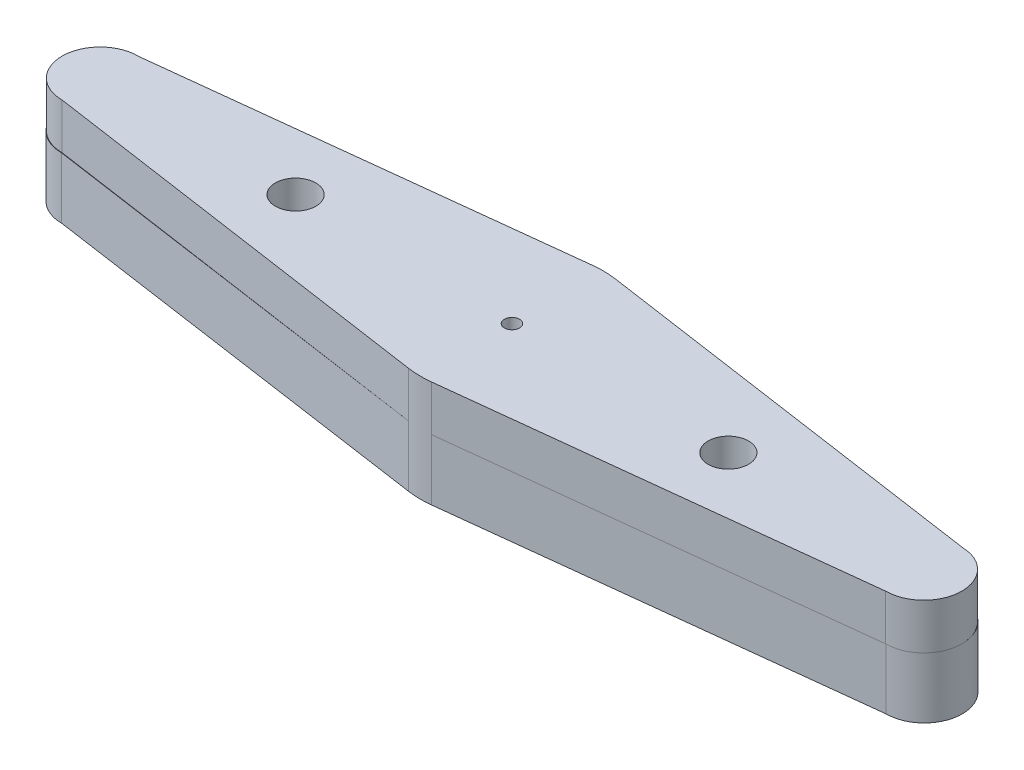
from build123d import *

# Parameters (mm, degrees)
BOSS_EXTRUDE2_DEPTH = 4
SKETCH2_R           = 0.5
SKETCH2_R_2         = 1.33
BOSS_EXTRUDE5_DEPTH = 3


with BuildPart() as part:
    # Sketch1 → Boss-Extrude2 (new body)
    with BuildSketch(Plane(origin=(0, 0, 0), x_dir=(1, 0, 0), z_dir=(0, 1, 0))):
        with BuildLine():
            ThreePointArc((27.5, -2.917608197), (29.999711791, -0.455568202), (27.575911257, 2.081239034))
            Line((27.575911257, 2.081239034), (0.857295011, 5.938437948))
            ThreePointArc((0.857295011, 5.938437948), (0.090022516, 5.999324624), (-0.678731386, 5.961486703))
            Line((-0.678731386, 5.961486703), (-27.424088743, 2.916455427))
            ThreePointArc((-27.424088743, 2.916455427), (-29.999711791, 0.455568202), (-27.5, -2.082391803))
            Line((-27.5, -2.082391803), (-0.859435998, -5.938128473))
            ThreePointArc((-0.859435998, -5.938128473), (-0.092185505, -5.999291778), (0.676581989, -5.961731025))
            Line((0.676581989, -5.961731025), (27.5, -2.917608197))
        make_face()
        with BuildLine():
            ThreePointArc((-17, -1.741842206), (-19, 0.258157794), (-17, 2.258157794))
            Line((-17, 2.258157794), (-0.65313587, 3.692683785))
            ThreePointArc((-0.65313587, 3.692683785), (-0.327822976, 3.735643465), (0, 3.75))
            ThreePointArc((0, 3.75), (0.43991732, 3.724106974), (0.873759552, 3.646785467))
            Line((0.873759552, 3.646785467), (17, 1.741842206))
            ThreePointArc((17, 1.741842206), (19, -0.258157794), (17, -2.258157794))
            Line((17, -2.258157794), (0.65313587, -3.692683785))
            ThreePointArc((0.65313587, -3.692683785), (0.327822976, -3.735643465), (0, -3.75))
            ThreePointArc((0, -3.75), (-0.43991732, -3.724106974), (-0.873759552, -3.646785467))
            Line((-0.873759552, -3.646785467), (-17, -1.741842206))
        make_face(mode=Mode.SUBTRACT)
    extrude(amount=BOSS_EXTRUDE2_DEPTH)

    # Sketch2 → Boss-Extrude5 (add)
    with BuildSketch(Plane(origin=(0, 4, 0), x_dir=(1, 0, 0), z_dir=(0, 1, 0))):
        with BuildLine():
            Line((27.580974078, 2.053213999), (0.863235763, 5.937577285))
            ThreePointArc((0.863235763, 5.937577285), (0.096028041, 5.999231502), (-0.6727599, 5.962163543))
            Line((-0.6727599, 5.962163543), (-27.419025922, 2.944162592))
            ThreePointArc((-27.419025922, 2.944162592), (-29.999672052, 0.485966647), (-27.5, -2.054525704))
            Line((-27.5, -2.054525704), (-0.865519194, -5.93724486))
            ThreePointArc((-0.865519194, -5.93724486), (-0.09833524, -5.999194128), (0.6704669, -5.962421835))
            Line((0.6704669, -5.962421835), (27.5, -2.945474296))
            ThreePointArc((27.5, -2.945474296), (29.999672052, -0.485966647), (27.580974078, 2.053213999))
        make_face()
        with Locations(Location((0, 0, 0), (0, 0, 270))):
            Circle(SKETCH2_R, mode=Mode.SUBTRACT)
        with Locations(Location((-14.45, 0.234076494, 0), (0, 0, 270))):
            Circle(SKETCH2_R_2, mode=Mode.SUBTRACT)
        with Locations(Location((14.45, -0.234076494, 0), (0, 0, 270))):
            Circle(SKETCH2_R_2, mode=Mode.SUBTRACT)
    extrude(amount=BOSS_EXTRUDE5_DEPTH)


solid = part.part
